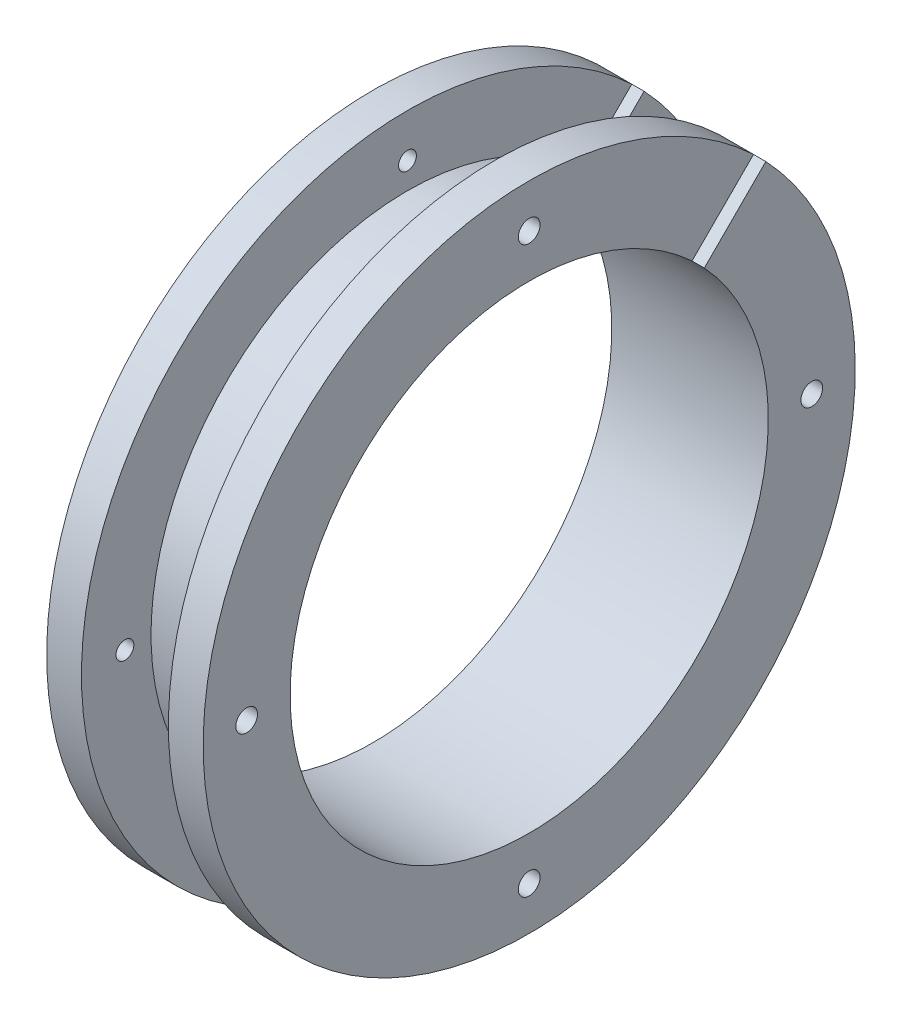
from build123d import *

# Parameters (mm, degrees)
M2_5X0_45_TAPPED_HOLE2_D     = 2.05
M2_5X0_45_TAPPED_HOLE2_DEPTH = 6.35
M2_5X0_45_TAPPED_HOLE2_TIP   = 0.615882135
M3X0_5_TAPPED_HOLE1_D        = 2.5
M3X0_5_TAPPED_HOLE1_DEPTH    = 7.5
M3X0_5_TAPPED_HOLE1_TIP      = 0.751075774
CUT_EXTRUDE1_DEPTH           = 57.004464108


with BuildPart() as part:
    # Sketch1 → Revolve1 (revolve)
    with BuildSketch(Plane.XY, mode=Mode.PRIVATE) as revolve1_sk:
        Polygon((-18, 27.5), (0, 27.5), (0, 37.5), (-4, 37.5), (-4, 29.5), (-14, 29.5), (-14, 37.5), (-18, 37.5), align=None)
    revolve(revolve1_sk.sketch.rotate(Axis((0, 0, 0), (-1, 0, 0)), 90), axis=Axis((0, 0, 0), (-1, 0, 0)))

    # M2.5x0.45 Tapped Hole2
    with Locations(Plane.ZY.offset(18)):
        with Locations((0, -32.5), (-32.5, 0), (32.5, 0), (0, 32.5)):
            Hole(M2_5X0_45_TAPPED_HOLE2_D / 2, depth=M2_5X0_45_TAPPED_HOLE2_DEPTH)
            with Locations((0, 0, -(M2_5X0_45_TAPPED_HOLE2_DEPTH + M2_5X0_45_TAPPED_HOLE2_TIP / 2))):  # 118° drill point
                Cone(0, M2_5X0_45_TAPPED_HOLE2_D / 2, M2_5X0_45_TAPPED_HOLE2_TIP, mode=Mode.SUBTRACT)

    # M3x0.5 Tapped Hole1
    with Locations(Plane(origin=(0, 0, 0), x_dir=(0, 0, -1), z_dir=(1, 0, 0))):
        with Locations((-32.5, 0), (0, -32.5), (32.5, 0), (0, 32.5)):
            Hole(M3X0_5_TAPPED_HOLE1_D / 2, depth=M3X0_5_TAPPED_HOLE1_DEPTH)
            with Locations((0, 0, -(M3X0_5_TAPPED_HOLE1_DEPTH + M3X0_5_TAPPED_HOLE1_TIP / 2))):  # 118° drill point
                Cone(0, M3X0_5_TAPPED_HOLE1_D / 2, M3X0_5_TAPPED_HOLE1_TIP, mode=Mode.SUBTRACT)

    # Sketch8 → Cut-Extrude1 (cut, through all)
    with BuildSketch(Plane.ZY.offset(18)):
        Polygon((-27.223611076, 25.809397513), (-25.809397513, 27.223611076), (-18.725468962, 20.139682524), (-20.139682524, 18.725468962), align=None)
    extrude(amount=-CUT_EXTRUDE1_DEPTH, mode=Mode.SUBTRACT)


solid = part.part
